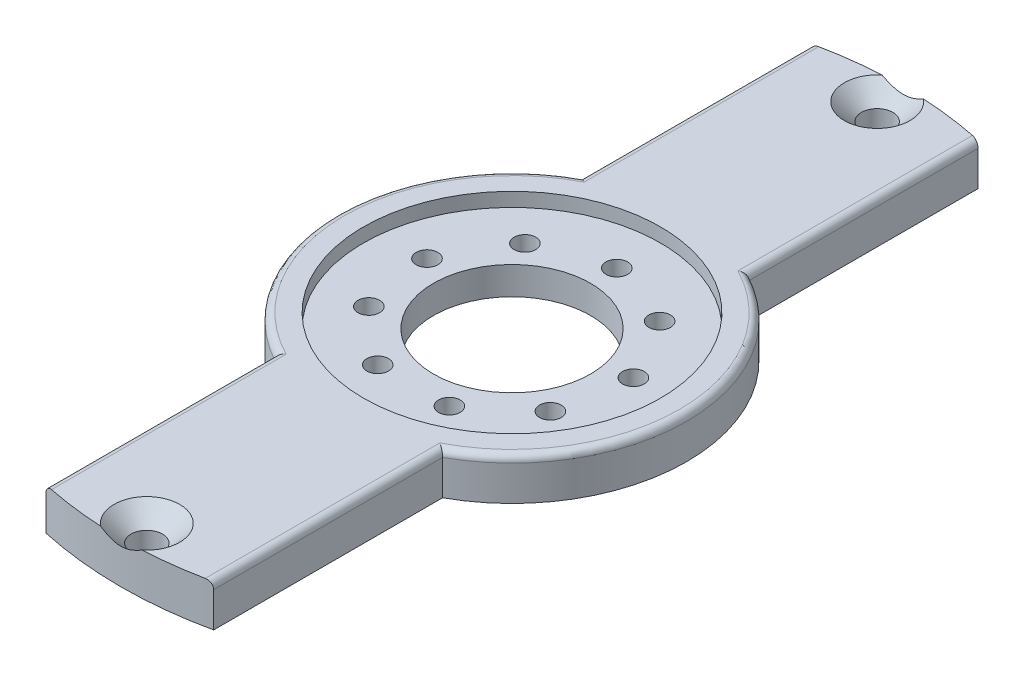
from build123d import *

# Parameters (mm, degrees)
BOSS_EXTRUDE2_DEPTH                             = 6
CSK_FOR_M4_FLAT_HEAD_MACHINE_SCREW1_D           = 4.5
CSK_FOR_M4_FLAT_HEAD_MACHINE_SCREW1_CSINK_D     = 9.4
CSK_FOR_M4_FLAT_HEAD_MACHINE_SCREW1_CSINK_ANGLE = 90
SKETCH7_R                                       = 21.25
CUT_EXTRUDE2_DEPTH                              = 2
SKETCH8_R                                       = 11.25
CUT_EXTRUDE3_DEPTH                              = 62.457302349
SKETCH9_R                                       = 1.55
CUT_EXTRUDE4_DEPTH                              = 62.457302349
FILLET1_R                                       = 1


with BuildPart() as part:
    # Sketch2 → Boss-Extrude2 (new body)
    with BuildSketch(Plane(origin=(0, 0, 0), x_dir=(1, 0, 0), z_dir=(0, 1, 0))):
        with BuildLine():
            ThreePointArc((0, -50), (-6.044327096, -49.633316532), (-12, -48.538644398))
            Line((-12, -48.538644398), (-12, -54.699177325))
            ThreePointArc((-12, -54.699177325), (-6.035149949, -55.673844533), (0, -56))
            Line((0, -56), (0, -54.269322199))
            ThreePointArc((0, -54.269322199), (-2, -52.269322199), (0, -50.269322199))
            Line((0, -50.269322199), (0, -50))
        make_face()
        with BuildLine():
            ThreePointArc((2, -52.269322199), (1.414213562, -50.855108637), (0, -50.269322199))
            Line((0, -50.269322199), (0, -54.269322199))
            ThreePointArc((0, -54.269322199), (1.414213562, -53.683535761), (2, -52.269322199))
        make_face()
        with BuildLine():
            Line((0, -54.269322199), (0, -50.269322199))
            ThreePointArc((0, -50.269322199), (-2, -52.269322199), (0, -54.269322199))
        make_face()
        with BuildLine():
            ThreePointArc((2, -52.269322199), (1.414213562, -50.855108637), (0, -50.269322199))
            Line((0, -50.269322199), (0, -54.269322199))
            ThreePointArc((0, -54.269322199), (1.414213562, -53.683535761), (2, -52.269322199))
        make_face()
        with BuildLine():
            Line((0, -54.269322199), (0, -50.269322199))
            ThreePointArc((0, -50.269322199), (-2, -52.269322199), (0, -54.269322199))
        make_face()
        with BuildLine():
            Line((12, -54.699177325), (12, -48.538644398))
            ThreePointArc((12, -48.538644398), (6.044327096, -49.633316532), (0, -50))
            Line((0, -50), (0, -50.269322199))
            ThreePointArc((0, -50.269322199), (1.414213562, -50.855108637), (2, -52.269322199))
            ThreePointArc((2, -52.269322199), (1.414213562, -53.683535761), (0, -54.269322199))
            Line((0, -54.269322199), (0, -56))
            ThreePointArc((0, -56), (6.035149949, -55.673844533), (12, -54.699177325))
        make_face()
        with BuildLine():
            Line((0, -48.538644398), (-12, -48.538644398))
            ThreePointArc((-12, -48.538644398), (-6.044327096, -49.633316532), (0, -50))
            Line((0, -50), (0, -48.538644398))
        make_face()
        with BuildLine():
            Line((12, -48.538644398), (0, -48.538644398))
            Line((0, -48.538644398), (0, -50))
            ThreePointArc((0, -50), (6.044327096, -49.633316532), (12, -48.538644398))
        make_face()
        with BuildLine():
            ThreePointArc((0, -25), (-6.193028137, -24.220784514), (-12, -21.931712199))
            Line((-12, -21.931712199), (-12, -48.538644398))
            Line((-12, -48.538644398), (0, -48.538644398))
            Line((0, -48.538644398), (0, -25))
        make_face()
        with BuildLine():
            ThreePointArc((12, -21.931712199), (6.193028137, -24.220784514), (0, -25))
            Line((0, -25), (0, -48.538644398))
            Line((0, -48.538644398), (12, -48.538644398))
            Line((12, -48.538644398), (12, -21.931712199))
        make_face()
        with BuildLine():
            Line((0, -48.538644398), (-12, -48.538644398))
            ThreePointArc((-12, -48.538644398), (-6.044327096, -49.633316532), (0, -50))
            Line((0, -50), (0, -48.538644398))
        make_face()
        with BuildLine():
            Line((12, -48.538644398), (0, -48.538644398))
            Line((0, -48.538644398), (0, -50))
            ThreePointArc((0, -50), (6.044327096, -49.633316532), (12, -48.538644398))
        make_face()
        with BuildLine():
            ThreePointArc((-12, 48.538644398), (-6.044327096, 49.633316532), (0, 50))
            Line((0, 50), (0, 50.269322199))
            ThreePointArc((0, 50.269322199), (-2, 52.269322199), (0, 54.269322199))
            Line((0, 54.269322199), (0, 56))
            ThreePointArc((0, 56), (-6.035149949, 55.673844533), (-12, 54.699177325))
            Line((-12, 54.699177325), (-12, 48.538644398))
        make_face()
        with BuildLine():
            ThreePointArc((0, 54.269322199), (-2, 52.269322199), (0, 50.269322199))
            Line((0, 50.269322199), (0, 54.269322199))
        make_face()
        with BuildLine():
            Line((0, 54.269322199), (0, 50.269322199))
            ThreePointArc((0, 50.269322199), (1.414213562, 50.855108637), (2, 52.269322199))
            ThreePointArc((2, 52.269322199), (1.414213562, 53.683535761), (0, 54.269322199))
        make_face()
        with BuildLine():
            ThreePointArc((0, 54.269322199), (-2, 52.269322199), (0, 50.269322199))
            Line((0, 50.269322199), (0, 54.269322199))
        make_face()
        with BuildLine():
            Line((0, 54.269322199), (0, 50.269322199))
            ThreePointArc((0, 50.269322199), (1.414213562, 50.855108637), (2, 52.269322199))
            ThreePointArc((2, 52.269322199), (1.414213562, 53.683535761), (0, 54.269322199))
        make_face()
        with BuildLine():
            Line((0, 50.269322199), (0, 50))
            ThreePointArc((0, 50), (6.044327096, 49.633316532), (12, 48.538644398))
            Line((12, 48.538644398), (12, 54.699177325))
            ThreePointArc((12, 54.699177325), (6.035149949, 55.673844533), (0, 56))
            Line((0, 56), (0, 54.269322199))
            ThreePointArc((0, 54.269322199), (1.414213562, 53.683535761), (2, 52.269322199))
            ThreePointArc((2, 52.269322199), (1.414213562, 50.855108637), (0, 50.269322199))
        make_face()
        with BuildLine():
            Line((-12, 48.538644398), (0, 48.538644398))
            Line((0, 48.538644398), (0, 50))
            ThreePointArc((0, 50), (-6.044327096, 49.633316532), (-12, 48.538644398))
        make_face()
        with BuildLine():
            Line((0, 50), (0, 48.538644398))
            Line((0, 48.538644398), (12, 48.538644398))
            ThreePointArc((12, 48.538644398), (6.044327096, 49.633316532), (0, 50))
        make_face()
        with BuildLine():
            Line((-12, 48.538644398), (0, 48.538644398))
            Line((0, 48.538644398), (0, 50))
            ThreePointArc((0, 50), (-6.044327096, 49.633316532), (-12, 48.538644398))
        make_face()
        with BuildLine():
            Line((0, 50), (0, 48.538644398))
            Line((0, 48.538644398), (12, 48.538644398))
            ThreePointArc((12, 48.538644398), (6.044327096, 49.633316532), (0, 50))
        make_face()
        with BuildLine():
            Line((0, 25), (0, 48.538644398))
            Line((0, 48.538644398), (-12, 48.538644398))
            Line((-12, 48.538644398), (-12, 21.931712199))
            ThreePointArc((-12, 21.931712199), (-6.193028137, 24.220784514), (0, 25))
        make_face()
        with BuildLine():
            Line((12, 48.538644398), (0, 48.538644398))
            Line((0, 48.538644398), (0, 25))
            ThreePointArc((0, 25), (6.193028137, 24.220784514), (12, 21.931712199))
            Line((12, 21.931712199), (12, 48.538644398))
        make_face()
        with BuildLine():
            ThreePointArc((12, 21.931712199), (6.193028137, 24.220784514), (0, 25))
            Line((0, 25), (0, 21.25))
            ThreePointArc((0, 21.25), (15.0260191, 15.0260191), (21.25, 0))
            ThreePointArc((21.25, 0), (15.0260191, -15.0260191), (0, -21.25))
            Line((0, -21.25), (0, -25))
            ThreePointArc((0, -25), (6.193028137, -24.220784514), (12, -21.931712199))
            ThreePointArc((12, -21.931712199), (21.505813168, -12.747548784), (25, 0))
            ThreePointArc((25, 0), (21.505813168, 12.747548784), (12, 21.931712199))
        make_face()
        with BuildLine():
            Line((0, 21.25), (0, 25))
            ThreePointArc((0, 25), (-6.193028137, 24.220784514), (-12, 21.931712199))
            ThreePointArc((-12, 21.931712199), (-25, 0), (-12, -21.931712199))
            ThreePointArc((-12, -21.931712199), (-6.193028137, -24.220784514), (0, -25))
            Line((0, -25), (0, -21.25))
            ThreePointArc((0, -21.25), (-21.25, 0), (0, 21.25))
        make_face()
        with BuildLine():
            ThreePointArc((21.25, 0), (15.0260191, 15.0260191), (0, 21.25))
            Line((0, 21.25), (0, 0))
            Line((0, 0), (0, -21.25))
            ThreePointArc((0, -21.25), (15.0260191, -15.0260191), (21.25, 0))
        make_face()
        with BuildLine():
            Line((0, 0), (0, 21.25))
            ThreePointArc((0, 21.25), (-21.25, 0), (0, -21.25))
            Line((0, -21.25), (0, 0))
        make_face()
        with BuildLine():
            ThreePointArc((21.25, 0), (15.0260191, 15.0260191), (0, 21.25))
            Line((0, 21.25), (0, 0))
            Line((0, 0), (0, -21.25))
            ThreePointArc((0, -21.25), (15.0260191, -15.0260191), (21.25, 0))
        make_face()
        with BuildLine():
            Line((0, 0), (0, 21.25))
            ThreePointArc((0, 21.25), (-21.25, 0), (0, -21.25))
            Line((0, -21.25), (0, 0))
        make_face()
        with BuildLine():
            ThreePointArc((12, 21.931712199), (6.193028137, 24.220784514), (0, 25))
            Line((0, 25), (0, 21.25))
            ThreePointArc((0, 21.25), (15.0260191, 15.0260191), (21.25, 0))
            ThreePointArc((21.25, 0), (15.0260191, -15.0260191), (0, -21.25))
            Line((0, -21.25), (0, -25))
            ThreePointArc((0, -25), (6.193028137, -24.220784514), (12, -21.931712199))
            ThreePointArc((12, -21.931712199), (21.505813168, -12.747548784), (25, 0))
            ThreePointArc((25, 0), (21.505813168, 12.747548784), (12, 21.931712199))
        make_face()
        with BuildLine():
            Line((0, 21.25), (0, 25))
            ThreePointArc((0, 25), (-6.193028137, 24.220784514), (-12, 21.931712199))
            ThreePointArc((-12, 21.931712199), (-25, 0), (-12, -21.931712199))
            ThreePointArc((-12, -21.931712199), (-6.193028137, -24.220784514), (0, -25))
            Line((0, -25), (0, -21.25))
            ThreePointArc((0, -21.25), (-21.25, 0), (0, 21.25))
        make_face()
    extrude(amount=BOSS_EXTRUDE2_DEPTH)

    # CSK for M4 Flat Head Machine Screw1 (through all)
    with Locations(Plane(origin=(0, 6, 0), x_dir=(1, 0, 0), z_dir=(0, 1, 0))):
        with Locations((0, 52.269322197)):
            csk_for_m4_flat_head_machine_screw1 = CounterSinkHole(CSK_FOR_M4_FLAT_HEAD_MACHINE_SCREW1_D / 2, CSK_FOR_M4_FLAT_HEAD_MACHINE_SCREW1_CSINK_D / 2, counter_sink_angle=CSK_FOR_M4_FLAT_HEAD_MACHINE_SCREW1_CSINK_ANGLE)

    # Mirror1: CSK for M4 Flat Head Machine Screw1 across plane
    add(csk_for_m4_flat_head_machine_screw1.mirror(Plane.XY), mode=Mode.SUBTRACT)

    # Sketch7 → Cut-Extrude2 (cut)
    with BuildSketch(Plane(origin=(0, 6, 0), x_dir=(1, 0, 0), z_dir=(0, 1, 0))):
        with Locations(Location((0, 0, 0), (0, 0, 270))):
            Circle(SKETCH7_R)
    extrude(amount=-CUT_EXTRUDE2_DEPTH, mode=Mode.SUBTRACT)

    # Sketch8 → Cut-Extrude3 (cut, through all)
    with BuildSketch(Plane(origin=(0, 4, 0), x_dir=(1, 0, 0), z_dir=(0, 1, 0))):
        with Locations(Location((0, 0, 0), (0, 0, 270))):
            Circle(SKETCH8_R)
    extrude(amount=-CUT_EXTRUDE3_DEPTH, mode=Mode.SUBTRACT)

    # Sketch9 → Cut-Extrude4 (cut, through all)
    with BuildSketch(Plane(origin=(0, 4, 0), x_dir=(1, 0, 0), z_dir=(0, 1, 0))):
        with Locations(Location((0, 15, 0), (0, 0, 270))):
            Circle(SKETCH9_R)
        with Locations(Location((9.641814145, 11.490666647, 0), (0, 0, 270))):
            Circle(SKETCH9_R)
        with Locations(Location((14.772116295, 2.604722665, 0), (0, 0, 270))):
            Circle(SKETCH9_R)
        with Locations(Location((12.990381057, -7.5, 0), (0, 0, 270))):
            Circle(SKETCH9_R)
        with Locations(Location((5.13030215, -14.095389312, 0), (0, 0, 270))):
            Circle(SKETCH9_R)
        with Locations(Location((-5.13030215, -14.095389312, 0), (0, 0, 270))):
            Circle(SKETCH9_R)
        with Locations(Location((-12.990381057, -7.5, 0), (0, 0, 270))):
            Circle(SKETCH9_R)
        with Locations(Location((-14.772116295, 2.604722665, 0), (0, 0, 270))):
            Circle(SKETCH9_R)
        with Locations(Location((-9.641814145, 11.490666647, 0), (0, 0, 270))):
            Circle(SKETCH9_R)
    extrude(amount=-CUT_EXTRUDE4_DEPTH, mode=Mode.SUBTRACT)

    # Fillet1
    fillet1_edges = [part.edges().sort_by_distance(p)[0] for p in [
        (-12, 6, -38.315444762),
        (-25, 6, 0),
        (-12, 6, 38.315444762),
        (12, 6, 38.315444762),
        (25, 6, 0),
        (12, 6, -38.315444762),
    ]]
    fillet(fillet1_edges, radius=FILLET1_R)


solid = part.part
